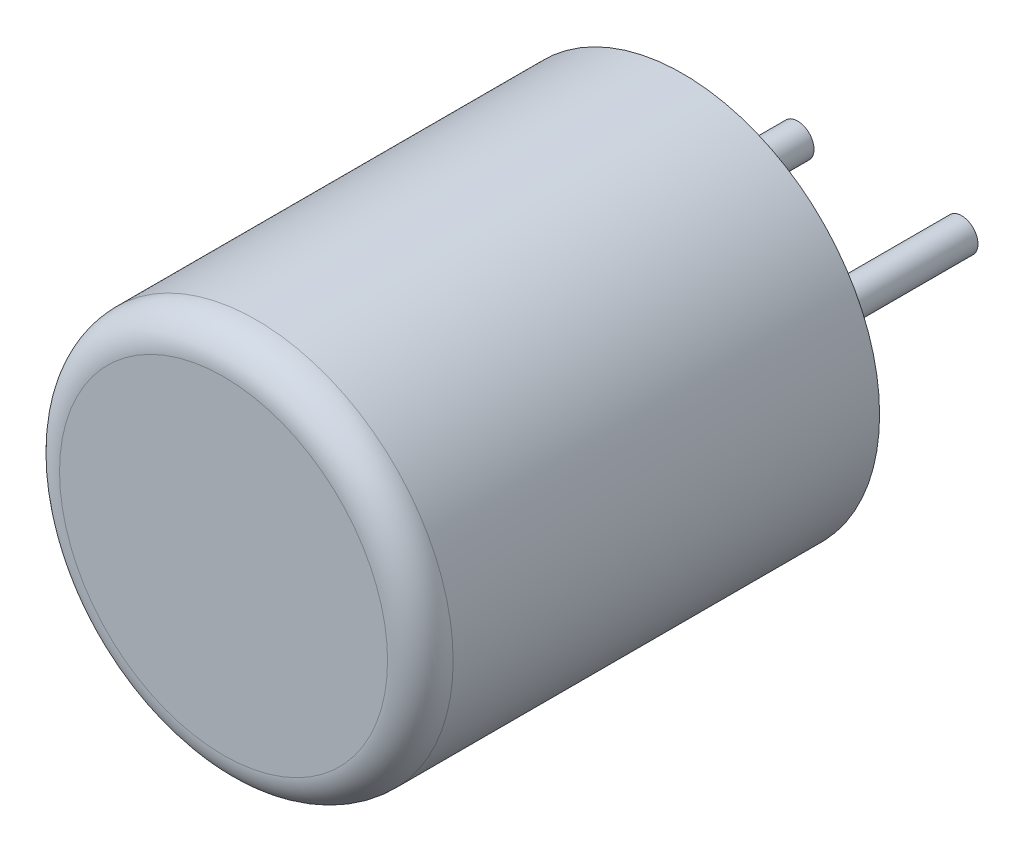
from build123d import *

# Parameters (mm, degrees)
SKETCH_1_R      = 3
EXTRUDE_1_DEPTH = 7
SKETCH_2_R      = 0.25
EXTRUDE_2_DEPTH = 3
FILLET_1_R      = 0.5


with BuildPart() as part:
    # Эскиз1 → Вытянуть1 (new body)
    with BuildSketch(Plane.XY):
        Circle(SKETCH_1_R)
    extrude(amount=EXTRUDE_1_DEPTH)

    # Эскиз2 → Вытянуть2 (add)
    with BuildSketch(Plane(origin=(0, 0, 0), x_dir=(-1, 0, 0), z_dir=(0, 0, -1))):
        with Locations(Location((-1.25, 0, 0), (0, 0, 180))):
            Circle(SKETCH_2_R)
        with Locations(Location((1.25, 0, 0), (0, 0, 180))):
            Circle(SKETCH_2_R)
    extrude(amount=EXTRUDE_2_DEPTH)

    # Скругление1
    fillet_1_edges = [part.edges().sort_by_distance(p)[0] for p in [
        (-3, 0, 7),
    ]]
    fillet(fillet_1_edges, radius=FILLET_1_R)


solid = part.part
